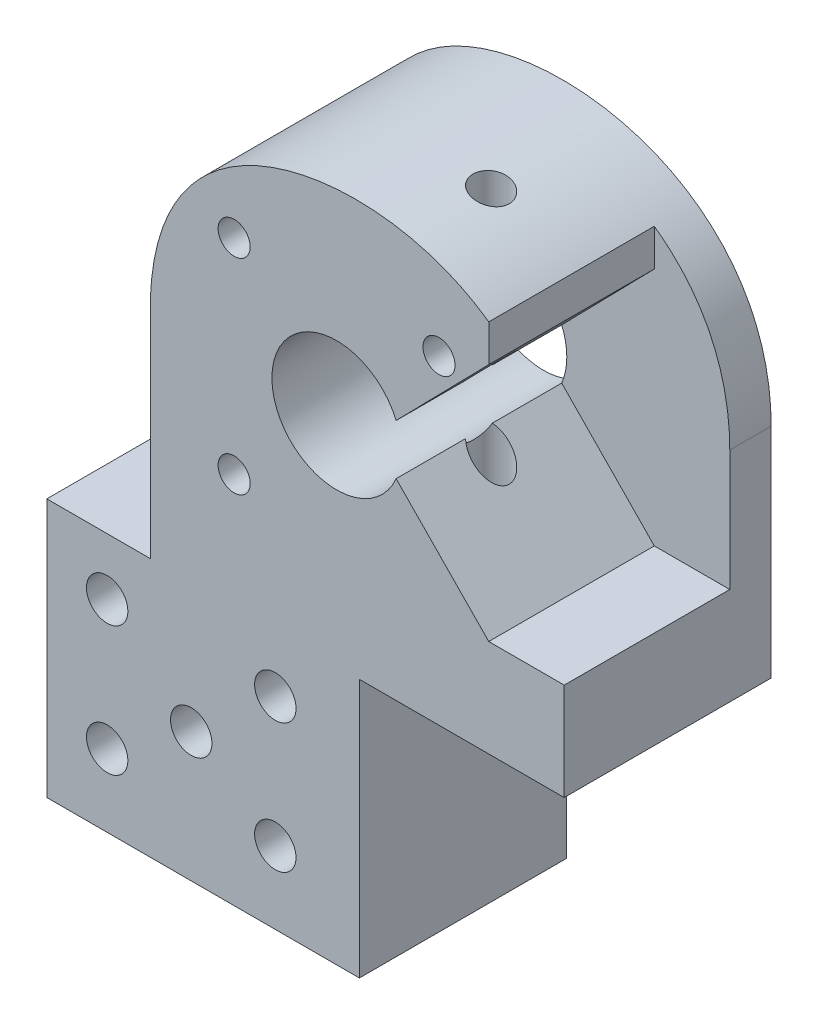
from build123d import *

# Parameters (mm, degrees)
SCHIZZO1_R                   = 2
SCHIZZO1_R_2                 = 1.55
SCHIZZO1_R_3                 = 6.25
ESTRUSIONE_ESTRUSIONE1_DEPTH = 20
TAGLIO_ESTRUSIONE3_DEPTH     = 16
SCHIZZO5_R                   = 1.75
TAGLIO_ESTRUSIONE4_DEPTH     = 68.079836494


with BuildPart() as part:
    # Schizzo1 → Estrusione-Estrusione1 (new body)
    with BuildSketch(Plane.XY):
        with BuildLine():
            Line((0, 0), (30.205221293, 0))
            Line((30.205221293, 0), (30.205221293, 25.000000003))
            Line((30.205221293, 25.000000003), (50, 25.000000003))
            Line((50, 25.000000003), (50, 46.083449556))
            add(Edge.make_bspline(
                [(10, 45.902878326), (10, 53.523029111), (16.665197751, 64.749431614), (39.917897707, 66.566627657), (50, 55.41391796), (50, 46.083449556)],
                knots=[0, 0, 0, 0, 0.305409074, 0.638645938, 1, 1, 1, 1], degree=3))
            Line((10, 45.902878326), (10, 25))
            Line((10, 25), (0, 25))
            Line((0, 25), (0, 0))
        make_face()
        with Locations((5.830221293, 7.000447051)):
            Circle(SCHIZZO1_R, mode=Mode.SUBTRACT)
        with Locations((13.955221293, 12.5)):
            Circle(SCHIZZO1_R, mode=Mode.SUBTRACT)
        with Locations((22.080221293, 7.000447051)):
            Circle(SCHIZZO1_R, mode=Mode.SUBTRACT)
        with Locations((22.080221293, 19.500447051)):
            Circle(SCHIZZO1_R, mode=Mode.SUBTRACT)
        with Locations((5.830221293, 19.500447051)):
            Circle(SCHIZZO1_R, mode=Mode.SUBTRACT)
        with Locations((37.899494937, 55.899494937)):
            Circle(SCHIZZO1_R_2, mode=Mode.SUBTRACT)
        with Locations((28, 46)):
            Circle(SCHIZZO1_R_3, mode=Mode.SUBTRACT)
        with Locations((18.100505063, 36.100505063)):
            Circle(SCHIZZO1_R_2, mode=Mode.SUBTRACT)
        with Locations((18.100505063, 55.899494937)):
            Circle(SCHIZZO1_R_2, mode=Mode.SUBTRACT)
    extrude(amount=-ESTRUSIONE_ESTRUSIONE1_DEPTH)

    # Schizzo4 → Taglio-Estrusione3 (cut)
    with BuildSketch(Plane.XY):
        Polygon((42.707691964, 34.412315024), (50, 34.412315024), (50, 57.587684976), (50, 63.39531064), (42.707691964, 63.39531064), (42.707691964, 57.587684976), (33.442882673, 48.113516989), (33.442882673, 43.886483011), align=None)
    extrude(amount=-TAGLIO_ESTRUSIONE3_DEPTH, mode=Mode.SUBTRACT)

    # Schizzo5 → Taglio-Estrusione4 (cut, through all)
    with BuildSketch(Plane(origin=(0, 25.000000003, 0), x_dir=(1, 0, 0), z_dir=(0, 1, 0))):
        with Locations(Location((34.937925583, 8, 0), (0, 0, 90))):
            Circle(SCHIZZO5_R)
    extrude(amount=TAGLIO_ESTRUSIONE4_DEPTH, mode=Mode.SUBTRACT)


solid = part.part
